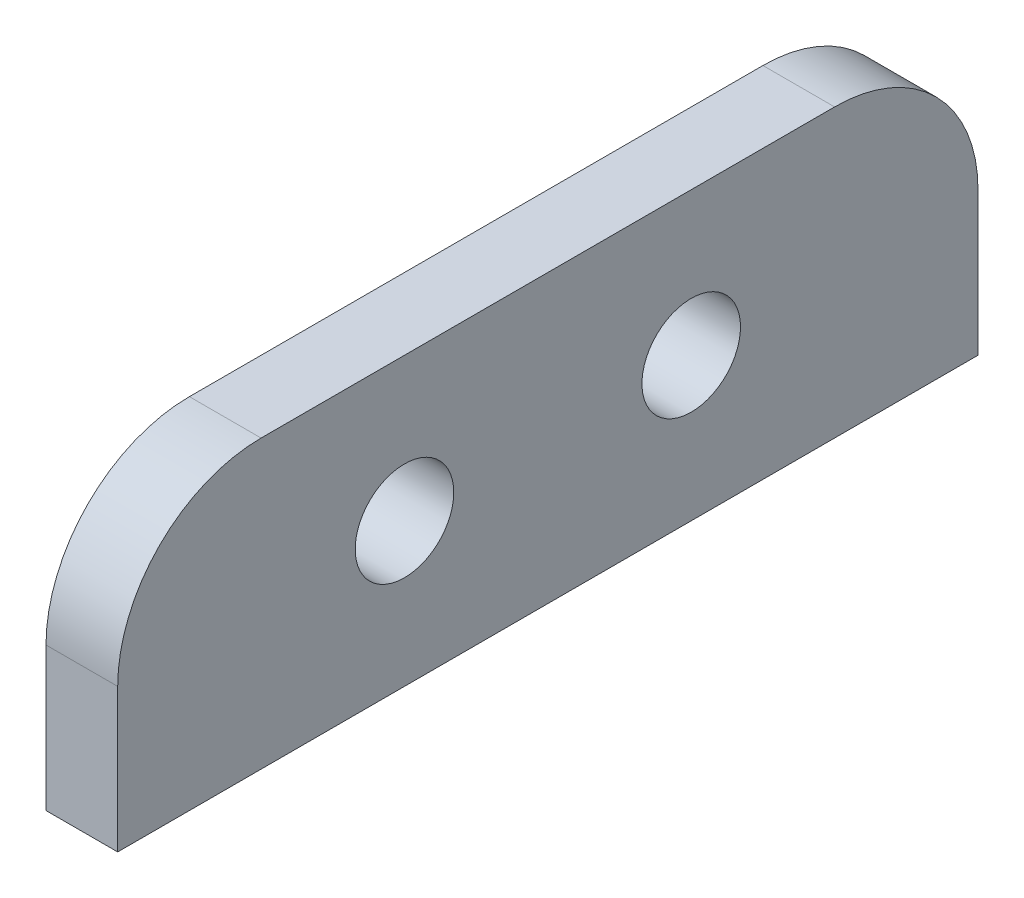
from build123d import *

# Parameters (mm, degrees)
SKETCH1_W           = 48
SKETCH1_H           = 16
SKETCH1_R           = 2.75
BOSS_EXTRUDE1_DEPTH = 4
FILLET1_R           = 8


with BuildPart() as part:
    # Sketch1 → Boss-Extrude1 (new body)
    with BuildSketch(Plane(origin=(0, 0, 0), x_dir=(0, 0, -1), z_dir=(1, 0, 0))):
        Rectangle(SKETCH1_W, SKETCH1_H)
        with Locations((-8, 0)):
            Circle(SKETCH1_R, mode=Mode.SUBTRACT)
        with Locations((8, 0)):
            Circle(SKETCH1_R, mode=Mode.SUBTRACT)
    extrude(amount=BOSS_EXTRUDE1_DEPTH)

    # Fillet1
    fillet1_edges = [part.edges().sort_by_distance(p)[0] for p in [
        (2, 8, 24),
        (2, 8, -24),
    ]]
    fillet(fillet1_edges, radius=FILLET1_R)


solid = part.part
